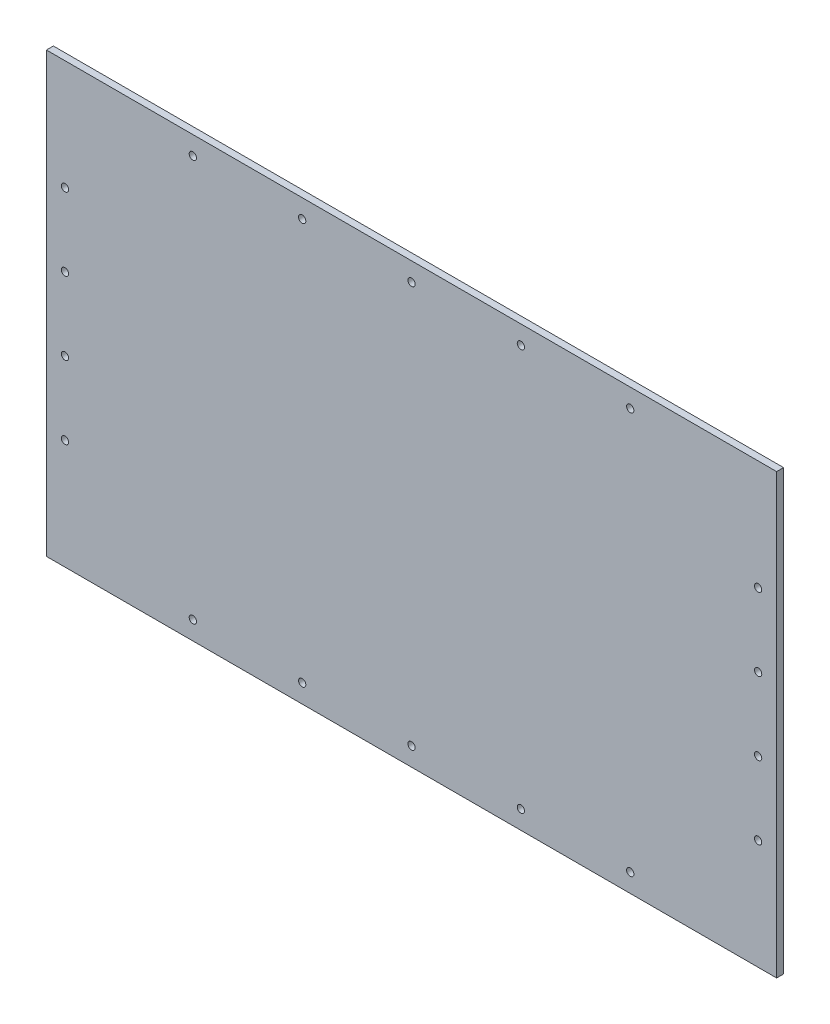
from build123d import *

# Parameters (mm, degrees)
SKETCH_1_W          = 500.8
SKETCH_1_H          = 300.8
EXTRUDE_1_DEPTH     = 4.75
SKETCH_3_R          = 2.5
CUT_EXTRUDE_1_DEPTH = 10
SKETCH_4_R          = 2.5
CUT_EXTRUDE_2_DEPTH = 10
SKETCH_5_R          = 2.5
CUT_EXTRUDE_3_DEPTH = 10
SKETCH_6_R          = 2.5
CUT_EXTRUDE_4_DEPTH = 10


with BuildPart() as part:
    # 草圖1 → 填料-伸長1 (new body)
    with BuildSketch(Plane.XY):
        Rectangle(SKETCH_1_W, SKETCH_1_H)
    extrude(amount=EXTRUDE_1_DEPTH)

    # 草圖3 → 除料-伸長1 (cut)
    with BuildSketch(Plane(origin=(0, 0, 0), x_dir=(-1, 0, 0), z_dir=(0, 0, -1))):
        with Locations((-150, 137.7)):
            Circle(SKETCH_3_R)
        with Locations((-75, 137.7)):
            Circle(SKETCH_3_R)
        with Locations((0, 137.7)):
            Circle(SKETCH_3_R)
        with Locations((75, 137.7)):
            Circle(SKETCH_3_R)
        with Locations((150, 137.7)):
            Circle(SKETCH_3_R)
    extrude(amount=-CUT_EXTRUDE_1_DEPTH, mode=Mode.SUBTRACT)

    # 草圖4 → 除料-伸長2 (cut)
    with BuildSketch(Plane(origin=(0, 0, 0), x_dir=(-1, 0, 0), z_dir=(0, 0, -1))):
        with Locations((-237.7, 75)):
            Circle(SKETCH_4_R)
        with Locations((-237.7, 25)):
            Circle(SKETCH_4_R)
        with Locations((-237.7, -25)):
            Circle(SKETCH_4_R)
        with Locations((-237.7, -75)):
            Circle(SKETCH_4_R)
    extrude(amount=-CUT_EXTRUDE_2_DEPTH, mode=Mode.SUBTRACT)

    # 草圖5 → 除料-伸長3 (cut)
    with BuildSketch(Plane(origin=(0, 0, 0), x_dir=(-1, 0, 0), z_dir=(0, 0, -1))):
        with Locations((237.7, 75)):
            Circle(SKETCH_5_R)
        with Locations((237.7, 25)):
            Circle(SKETCH_5_R)
        with Locations((237.7, -25)):
            Circle(SKETCH_5_R)
        with Locations((237.7, -75)):
            Circle(SKETCH_5_R)
    extrude(amount=-CUT_EXTRUDE_3_DEPTH, mode=Mode.SUBTRACT)

    # 草圖6 → 除料-伸長4 (cut)
    with BuildSketch(Plane(origin=(0, 0, 0), x_dir=(-1, 0, 0), z_dir=(0, 0, -1))):
        with Locations((150, -137.7)):
            Circle(SKETCH_6_R)
        with Locations((75, -137.7)):
            Circle(SKETCH_6_R)
        with Locations((0, -137.7)):
            Circle(SKETCH_6_R)
        with Locations((-75, -137.7)):
            Circle(SKETCH_6_R)
        with Locations((-150, -137.7)):
            Circle(SKETCH_6_R)
    extrude(amount=-CUT_EXTRUDE_4_DEPTH, mode=Mode.SUBTRACT)


solid = part.part
